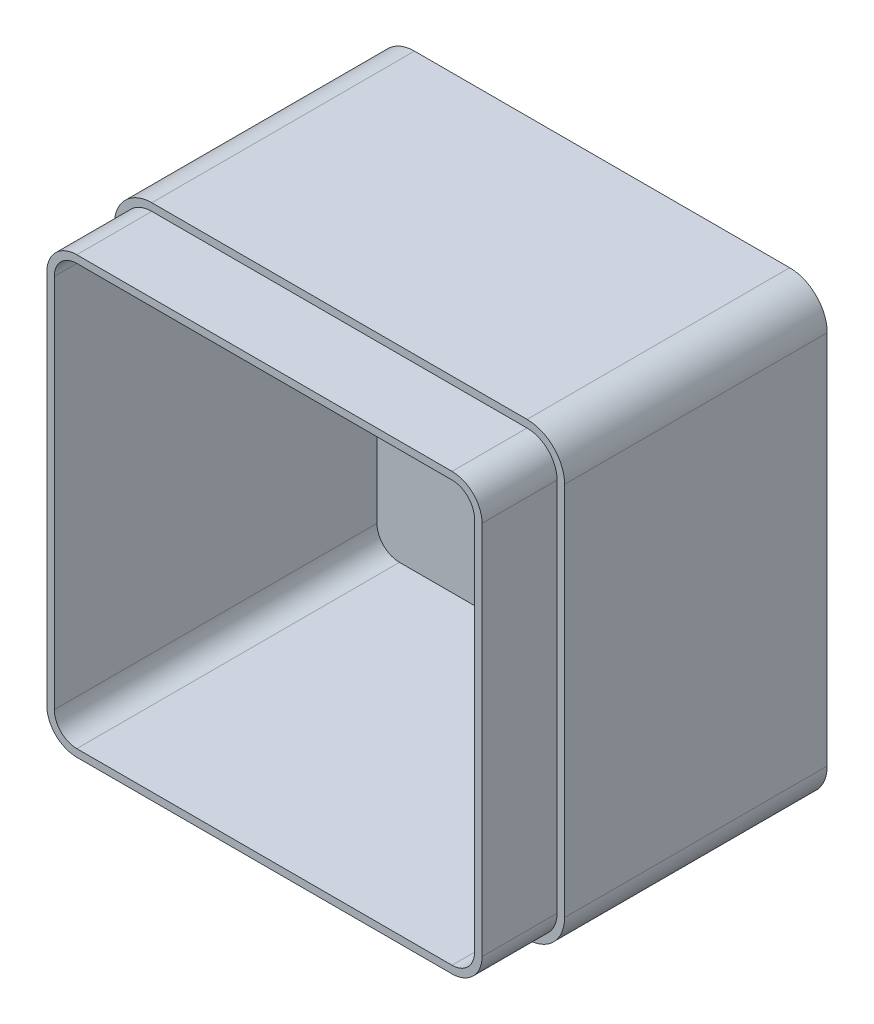
from build123d import *

# Parameters (mm, degrees)
SKETCH1_W           = 120
SKETCH1_H           = 120
BOSS_EXTRUDE1_DEPTH = 90
FILLET1_R           = 10
SHELL1_T            = -4
CUT_EXTRUDE2_DEPTH  = 20


with BuildPart() as part:
    # Sketch1 → Boss-Extrude1 (new body)
    with BuildSketch(Plane.XY):
        with Locations((60, -60)):
            Rectangle(SKETCH1_W, SKETCH1_H)
    extrude(amount=BOSS_EXTRUDE1_DEPTH)

    # Fillet1
    fillet1_edges = [part.edges().sort_by_distance(p)[0] for p in [
        (0, 0, 45),
        (120, 0, 45),
        (120, -120, 45),
        (0, -120, 45),
    ]]
    fillet(fillet1_edges, radius=FILLET1_R)

    # Shell1
    shell1_openings = [part.faces().sort_by_distance(p)[0] for p in [
        (60, -60, 90),
    ]]
    offset(amount=SHELL1_T, openings=shell1_openings, kind=Kind.INTERSECTION)

    # Sketch2 → Cut-Extrude2 (cut)
    with BuildSketch(Plane.XY.offset(90)):
        with BuildLine():
            Line((0, -10), (0, -110))
            ThreePointArc((0, -110), (2.928932188, -117.071067812), (10, -120))
            Line((10, -120), (110, -120))
            ThreePointArc((110, -120), (117.071067812, -117.071067812), (120, -110))
            Line((120, -110), (120, -10))
            ThreePointArc((120, -10), (117.071067812, -2.928932188), (110, 0))
            Line((110, 0), (10, 0))
            ThreePointArc((10, 0), (2.928932188, -2.928932188), (0, -10))
        make_face()
        with BuildLine():
            Line((2, -10), (2, -110))
            ThreePointArc((2, -110), (4.343145751, -115.656854249), (10, -118))
            Line((10, -118), (110, -118))
            ThreePointArc((110, -118), (115.656854249, -115.656854249), (118, -110))
            Line((118, -110), (118, -10))
            ThreePointArc((118, -10), (115.656854249, -4.343145751), (110, -2))
            Line((110, -2), (10, -2))
            ThreePointArc((10, -2), (4.343145751, -4.343145751), (2, -10))
        make_face(mode=Mode.SUBTRACT)
    extrude(amount=-CUT_EXTRUDE2_DEPTH, mode=Mode.SUBTRACT)


solid = part.part
